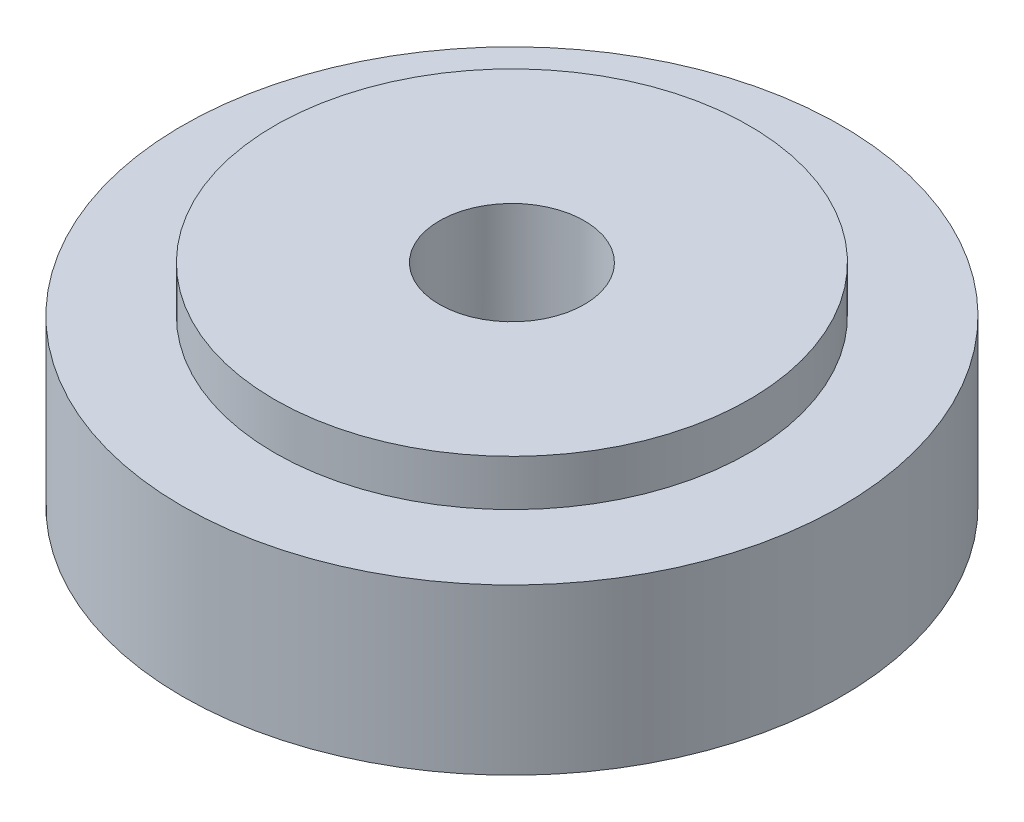
from build123d import *

# Parameters (mm, degrees)
SKETCH_1_R          = 5
EXTRUDE_1_DEPTH     = 2.5
SKETCH_2_R          = 3.6
EXTRUDE_2_DEPTH     = 0.7
SKETCH_3_R          = 1.1
CUT_EXTRUDE_1_DEPTH = 8.761443165
SKETCH_4_R          = 1.9
CUT_EXTRUDE_2_DEPTH = 1


with BuildPart() as part:
    # 草图1 → 凸台-拉伸1 (new body)
    with BuildSketch(Plane(origin=(0, 0, 0), x_dir=(1, 0, 0), z_dir=(0, 1, 0))):
        with Locations(Location((0, 0, 0), (0, 0, 270))):
            Circle(SKETCH_1_R)
    extrude(amount=EXTRUDE_1_DEPTH)

    # 草图2 → 凸台-拉伸2 (add)
    with BuildSketch(Plane(origin=(0, 2.5, 0), x_dir=(1, 0, 0), z_dir=(0, 1, 0))):
        with Locations(Location((0, 0, 0), (0, 0, 270))):
            Circle(SKETCH_2_R)
    extrude(amount=EXTRUDE_2_DEPTH)

    # 草图3 → 切除-拉伸1 (cut, through all)
    with BuildSketch(Plane(origin=(0, 3.2, 0), x_dir=(1, 0, 0), z_dir=(0, 1, 0))):
        with Locations(Location((0, 0, 0), (0, 0, 270))):
            Circle(SKETCH_3_R)
    extrude(amount=-CUT_EXTRUDE_1_DEPTH, mode=Mode.SUBTRACT)

    # 草图4 → 切除-拉伸2 (cut)
    with BuildSketch(Plane.XZ):
        with Locations(Location((0, 0, 0), (0, 0, 270))):
            Circle(SKETCH_4_R)
    extrude(amount=-CUT_EXTRUDE_2_DEPTH, mode=Mode.SUBTRACT)


solid = part.part
